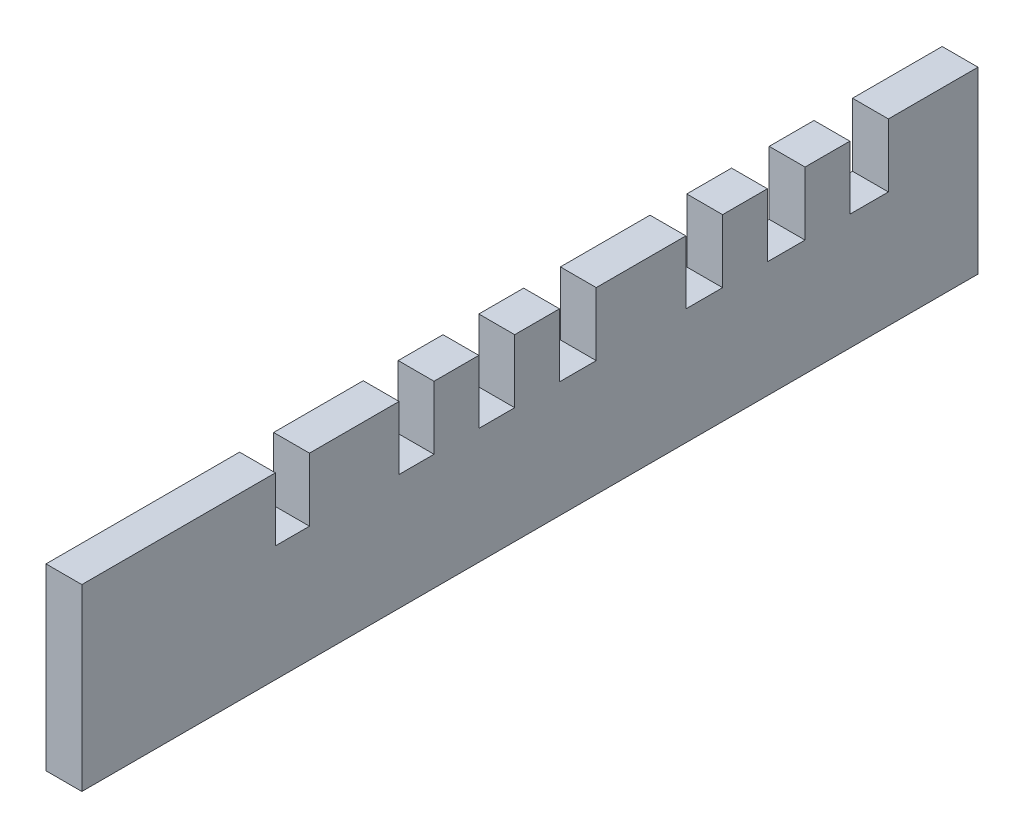
from build123d import *

# Parameters (mm, degrees)
SKETCH1_W           = 5.08
SKETCH1_H           = 25.4
BOSS_EXTRUDE1_DEPTH = 127
SKETCH9_W           = 5.461
SKETCH9_H           = 8.965485494
SKETCH9_W_2         = 5.334
SKETCH9_W_3         = 5.207
SKETCH9_W_4         = 5.08
SKETCH9_W_5         = 4.953
SKETCH9_W_6         = 4.826
CUT_EXTRUDE1_DEPTH  = 12.7


with BuildPart() as part:
    # Sketch1 → Boss-Extrude1 (new body)
    with BuildSketch(Plane.XY):
        with Locations((2.54, 12.7)):
            Rectangle(SKETCH1_W, SKETCH1_H)
    extrude(amount=BOSS_EXTRUDE1_DEPTH)

    # Sketch9 → Cut-Extrude1 (cut)
    with BuildSketch(Plane(origin=(5.08, 0, 0), x_dir=(0, 0, -1), z_dir=(1, 0, 0))):
        with Locations((-15.4305, 20.917257253)):
            Rectangle(SKETCH9_W, SKETCH9_H)
        with Locations((-27.178, 20.917257253)):
            Rectangle(SKETCH9_W_2, SKETCH9_H)
        with Locations((-38.7985, 20.917257253)):
            Rectangle(SKETCH9_W_3, SKETCH9_H)
        with Locations((-56.7055, 20.917257253)):
            Rectangle(SKETCH9_W_3, SKETCH9_H)
        with Locations((-68.199, 20.917257253)):
            Rectangle(SKETCH9_W_4, SKETCH9_H)
        with Locations((-79.5655, 20.917257253)):
            Rectangle(SKETCH9_W_5, SKETCH9_H)
        with Locations((-97.155, 20.917257253)):
            Rectangle(SKETCH9_W_6, SKETCH9_H)
    extrude(amount=-CUT_EXTRUDE1_DEPTH, mode=Mode.SUBTRACT)


solid = part.part
